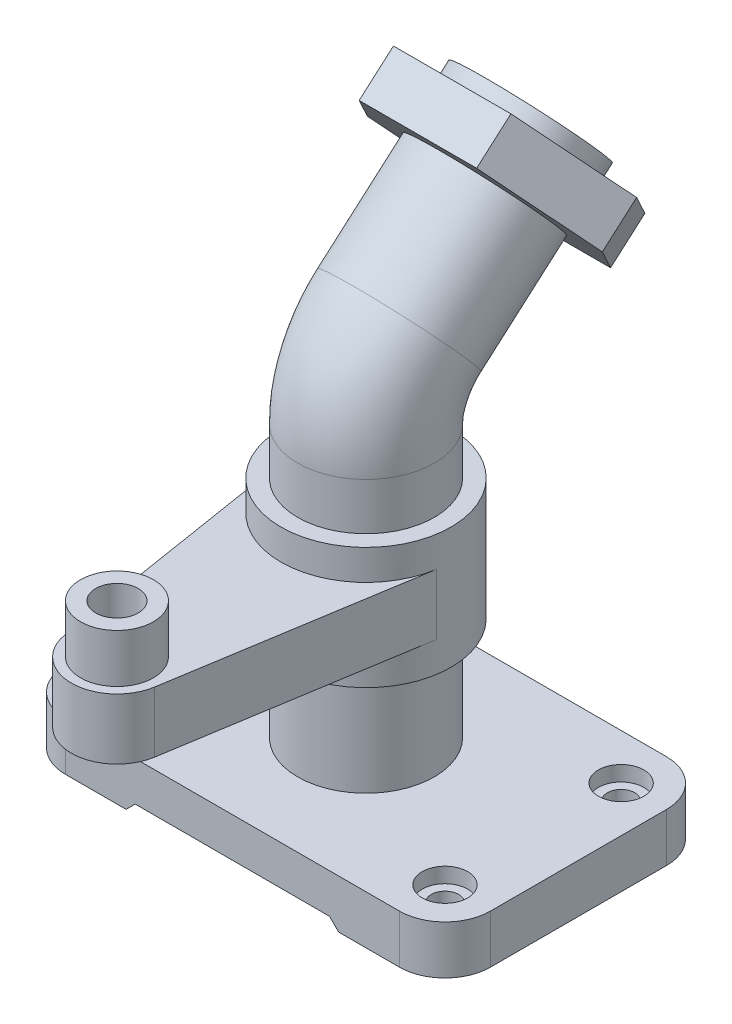
from build123d import *
from build123d.topology import SkipClean

# Parameters (mm, degrees)
SKETCH1_W               = 140
SKETCH1_H               = 88
BOSS_EXTRUDE1_DEPTH     = 16
FILLET1_R               = 15
HOLE2_D                 = 9
HOLE2_CBORE_D           = 15
HOLE2_CBORE_DEPTH       = 5
SWEEP1_PROFILE_R        = 22.5
CUT_SWEEP1_PROFILE_R    = 6
BOSS_EXTRUDE2_START     = 50
SKETCH21_R              = 28
BOSS_EXTRUDE2_DEPTH     = 40
BOSS_EXTRUDE3_DEPTH     = 10
CUT_EXTRUDE1_DEPTH      = 6
SKETCH27_R              = 12
BOSS_EXTRUDE4_DEPTH     = 16
CUT_EXTRUDE2_REACH      = 155.379
SKETCH28_R              = 7
CUT_SWEEP2_PROFILE_R    = 6
BOSS_EXTRUDE5_START     = -5
BOSS_EXTRUDE5_DEPTH     = 15
CUT_SWEEP3_PROFILE_R    = 15
SKETCH57_R              = 17.5
CUT_EXTRUDE3_DEPTH      = 56.4
CUT_EXTRUDE4_DEPTH      = 224.949486459
CUT_EXTRUDE4_DEPTH_BACK = 224.949486459


with BuildPart() as part:
    # Sketch1 → Boss-Extrude1 (new body)
    with BuildSketch(Plane(origin=(0, 0, 0), x_dir=(1, 0, 0), z_dir=(0, 1, 0))):
        Rectangle(SKETCH1_W, SKETCH1_H)
    extrude(amount=BOSS_EXTRUDE1_DEPTH)

    # Fillet1
    fillet1_edges = [part.edges().sort_by_distance(p)[0] for p in [
        (-70, 8, -44),
        (70, 8, -44),
        (-70, 8, 44),
        (70, 8, 44),
    ]]
    fillet(fillet1_edges, radius=FILLET1_R)

    # Hole2 (through all)
    with Locations(Plane(origin=(0, 16, 0), x_dir=(1, 0, 0), z_dir=(0, 1, 0))):
        with Locations((-55, 29), (55, 29), (-55, -29), (55, -29)):
            CounterBoreHole(HOLE2_D / 2, HOLE2_CBORE_D / 2, HOLE2_CBORE_DEPTH)

    # Sweep1: sweep along a path in Sketch6
    with BuildLine(Plane(origin=(0, 0, 0), x_dir=(0, 0, -1), z_dir=(1, 0, 0))) as sweep1_path:
        Line((0, 0), (0, 105.475997542))
        ThreePointArc((0, 105.475997542), (2.860918449, 118.701500419), (10.932120397, 129.562185473))
        Line((10.932120397, 129.562185473), (54.193922845, 167.402729106))
    # Sweep1 profile (on start of the path) → Sweep1 (sweep)
    with BuildSketch(Plane.ZX):
        Circle(SWEEP1_PROFILE_R)
    sweep(path=sweep1_path.line)

    # Cut-Sweep1: sweep along a path in Sketch6<5>
    with BuildLine(Plane(origin=(0, 0, 0), x_dir=(0, 0, -1), z_dir=(1, 0, 0))) as cut_sweep1_path:
        Line((0, 0), (0, 105.475997542))
        ThreePointArc((0, 105.475997542), (2.860918449, 118.701500419), (10.932120397, 129.562185473))
        Line((10.932120397, 129.562185473), (54.193922845, 167.402729106))
    # Cut-Sweep1 profile (on start of the path) → Cut-Sweep1 (sweep, cut)
    with BuildSketch(Plane.ZX):
        Circle(CUT_SWEEP1_PROFILE_R)
    sweep(path=cut_sweep1_path.line, mode=Mode.SUBTRACT)

    # Sketch21 → Boss-Extrude2 (add)
    with BuildSketch(Plane(origin=(0, 0, 0), x_dir=(1, 0, 0), z_dir=(0, 1, 0)).offset(BOSS_EXTRUDE2_START)):
        Circle(SKETCH21_R)
    extrude(amount=BOSS_EXTRUDE2_DEPTH)

    # Sketch23 → Boss-Extrude3 (add, symmetric)
    with BuildSketch(Plane(origin=(0, 70, 0), x_dir=(1, 0, 0), z_dir=(0, 1, 0))):
        with BuildLine():
            Line((-27.6458869, -4.43902439), (-14.810296553, -84.37804878))
            ThreePointArc((-14.810296553, -84.37804878), (0, -97), (14.810296553, -84.37804878))
            Line((14.810296553, -84.37804878), (27.6458869, -4.43902439))
            ThreePointArc((27.6458869, -4.43902439), (0, 28), (-27.6458869, -4.43902439))
        make_face()
    extrude(amount=BOSS_EXTRUDE3_DEPTH, both=True)

    # Sketch25 → Cut-Extrude1 (cut, symmetric)
    with BuildSketch(Plane(origin=(0, 70, 0), x_dir=(1, 0, 0), z_dir=(0, 1, 0))):
        with BuildLine():
            Line((10.860884139, -83.743902439), (23.696474485, -3.804878049))
            ThreePointArc((23.696474485, -3.804878049), (0, 24), (-23.696474485, -3.804878049))
            Line((-23.696474485, -3.804878049), (-10.860884139, -83.743902439))
            ThreePointArc((-10.860884139, -83.743902439), (0, -93), (10.860884139, -83.743902439))
        make_face()
    extrude(amount=CUT_EXTRUDE1_DEPTH, both=True, mode=Mode.SUBTRACT)

    # Sketch27 → Boss-Extrude4 (add)
    with BuildSketch(Plane(origin=(0, 80, 0), x_dir=(1, 0, 0), z_dir=(0, 1, 0))):
        with Locations((0, -82)):
            Circle(SKETCH27_R)
    extrude(amount=BOSS_EXTRUDE4_DEPTH)

    # Sketch28 → Cut-Extrude2 (cut, up to next)
    with BuildSketch(Plane(origin=(0, 96, 0), x_dir=(1, 0, 0), z_dir=(0, 1, 0)), mode=Mode.PRIVATE) as cut_extrude2_sk1:
        with Locations((0, -82)):
            Circle(SKETCH28_R)
    cut_extrude2_tool1 = extrude(cut_extrude2_sk1.sketch, amount=-CUT_EXTRUDE2_REACH, mode=Mode.PRIVATE) & part.part
    add(cut_extrude2_tool1.solids().sort_by_distance((0, 96, 82))[0], mode=Mode.SUBTRACT)

    # Sketch30 → Cut-Revolve1 (revolve, cut)
    with SkipClean():  # the faces are left unmerged after this step: merging them gives an invalid solid
        with BuildSketch(Plane(origin=(0, 0, 0), x_dir=(0, 0, -1), z_dir=(1, 0, 0))):
            Polygon((0, 0), (18.5, 0), (18.5, 54), (24, 54), (24, 86), (0, 86), align=None)
        revolve(axis=Axis((0, 86, 0), (0, -1, 0)), mode=Mode.SUBTRACT)
    add(part.part.scale(1), mode=Mode.REPLACE)  # the faces are merged on a copy

    # Cut-Sweep2: sweep along a path in Sketch6<6>
    with BuildLine(Plane(origin=(0, 0, 0), x_dir=(0, 0, -1), z_dir=(1, 0, 0))) as cut_sweep2_path:
        Line((0, 0), (0, 105.475997542))
        ThreePointArc((0, 105.475997542), (2.860918449, 118.701500419), (10.932120397, 129.562185473))
        Line((10.932120397, 129.562185473), (54.193922845, 167.402729106))
    # Cut-Sweep2 profile (on start of the path) → Cut-Sweep2 (sweep, cut)
    with BuildSketch(Plane.ZX):
        Circle(CUT_SWEEP2_PROFILE_R)
    sweep(path=cut_sweep2_path.line, mode=Mode.SUBTRACT)

    # Sketch41 → Boss-Extrude5 (add)
    with BuildSketch(Plane(origin=(0, 99.417051483, -113.660122933), x_dir=(-1, 0, 0), z_dir=(0, 0.6583712375823932, -0.752693372844632)).offset(BOSS_EXTRUDE5_START)):
        Polygon((19.341234018, 56.823204741), (38.682468036, 90.323204741), (19.341234018, 123.823204741), (-19.341234018, 123.823204741), (-38.682468036, 90.323204741), (-19.341234018, 56.823204741), align=None)
    extrude(amount=-BOSS_EXTRUDE5_DEPTH)

    # Cut-Sweep3: sweep along a path in Sketch43
    with BuildLine(Plane(origin=(0, 0, 0), x_dir=(0, 0, -1), z_dir=(1, 0, 0))) as cut_sweep3_path:
        Line((54.193922845, 167.402729106), (10.932120397, 129.562185473))
        ThreePointArc((10.932120397, 129.562185473), (6.509742227, 124.821455889), (3.133658129, 119.286656721))
    # Cut-Sweep3 profile (on start of the path) → Cut-Sweep3 (sweep, cut)
    with BuildSketch(Plane(origin=(0, 167.402729106, -54.193922845), x_dir=(0, 0.7526933728446314, 0.6583712375823938), z_dir=(0, -0.6583712375823938, 0.7526933728446314))):
        Circle(CUT_SWEEP3_PROFILE_R)
    sweep(path=cut_sweep3_path.line, mode=Mode.SUBTRACT)

    # Sketch57 → Cut-Extrude3 (cut)
    with BuildSketch(Plane(origin=(0, 99.417051483, -113.660122933), x_dir=(-1, 0, 0), z_dir=(0, 0.6583712375823932, -0.752693372844632))):
        with Locations((0, 90.323204741)):
            Circle(SKETCH57_R)
    extrude(amount=-CUT_EXTRUDE3_DEPTH, mode=Mode.SUBTRACT)

    # Sketch59 → Cut-Extrude4 (cut, two sides: drawn at the far end of the back side and taken through both)
    with BuildSketch(Plane.XY.offset(-CUT_EXTRUDE4_DEPTH_BACK)):
        Polygon((-35, 0), (35, 0), (32, 3), (-32, 3), align=None)
    extrude(amount=CUT_EXTRUDE4_DEPTH + CUT_EXTRUDE4_DEPTH_BACK, mode=Mode.SUBTRACT)


solid = part.part
